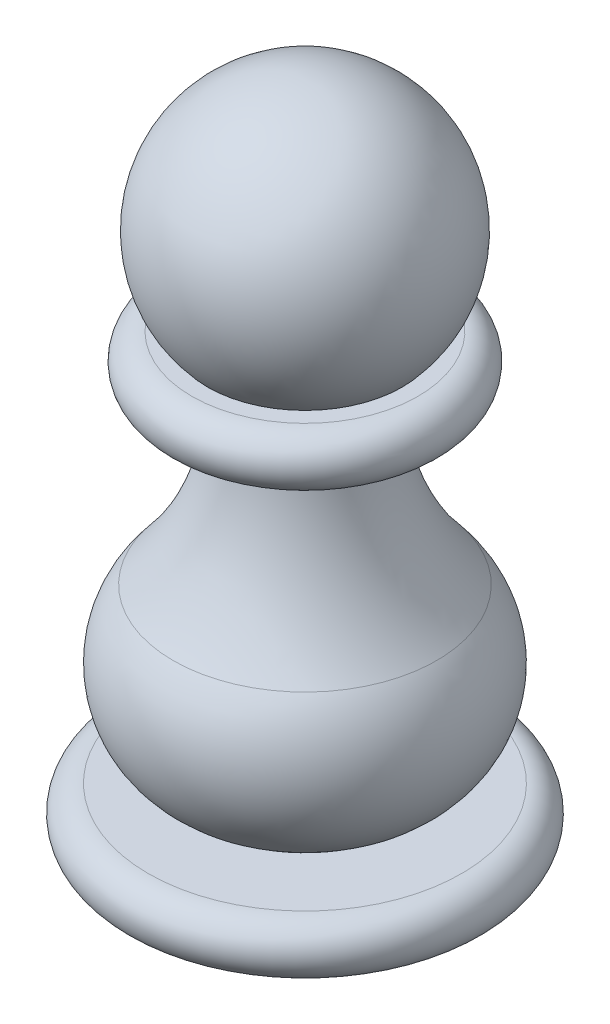
from build123d import *


with BuildPart() as part:
    # Sketch1 → Revolve1 (revolve)
    with BuildSketch(Plane.XY, mode=Mode.PRIVATE) as revolve1_sk:
        with BuildLine():
            Line((0, 0), (18, 0))
            ThreePointArc((18, 0), (20.999033082, 2.999033082), (18, 5.998066163))
            Line((18, 5.998066163), (6, 5.998066163))
            ThreePointArc((6, 5.998066163), (16.891968689, 12.961696631), (15.14266321, 25.770563152))
            ThreePointArc((15.14266321, 25.770563152), (9.876706736, 34.75582296), (8, 45))
            Line((8, 45), (13, 45))
            ThreePointArc((13, 45), (16, 48), (13, 51))
            Line((13, 51), (11.180339887, 51))
            ThreePointArc((11.180339887, 51), (13.693063938, 67.123724357), (0, 76))
            Line((0, 76), (0, 0))
        make_face()
    revolve(revolve1_sk.sketch.rotate(Axis((0, 0, 0), (0, -1, 0)), 90), axis=Axis((0, 0, 0), (0, -1, 0)))


solid = part.part
